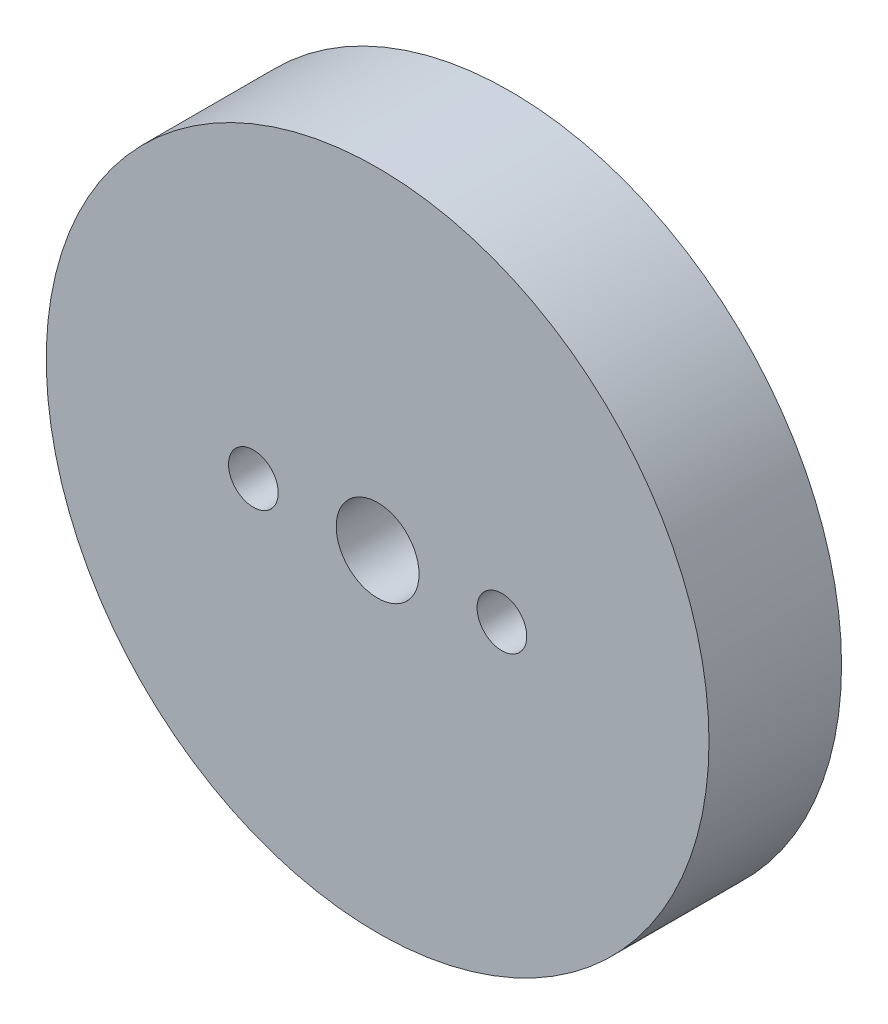
from build123d import *

# Parameters (mm, degrees)
SKETCH1_R           = 20
SKETCH1_R_2         = 2.5
SKETCH1_R_3         = 1.5
BOSS_EXTRUDE3_DEPTH = 8


with BuildPart() as part:
    # Sketch1 → Boss-Extrude3 (new body)
    with BuildSketch(Plane.XY):
        Circle(SKETCH1_R)
        Circle(SKETCH1_R_2, mode=Mode.SUBTRACT)
        with Locations((7.5, 0)):
            Circle(SKETCH1_R_3, mode=Mode.SUBTRACT)
        with Locations((-7.5, 0)):
            Circle(SKETCH1_R_3, mode=Mode.SUBTRACT)
    extrude(amount=BOSS_EXTRUDE3_DEPTH)


solid = part.part
